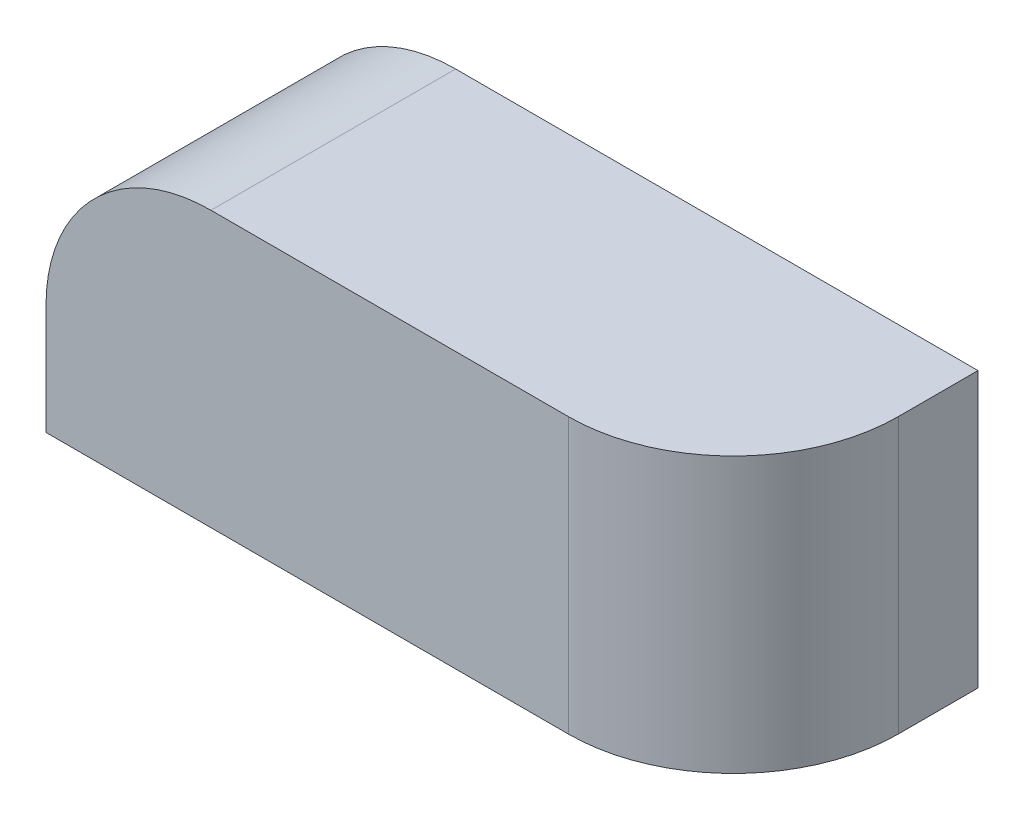
from build123d import *

# Parameters (mm, degrees)
BOSS_EXTRUDE1_DEPTH     = 89
CUT_EXTRUDE1_DEPTH      = 208.523246792
CUT_EXTRUDE1_DEPTH_BACK = 208.523246792
SKETCH3_OUTSIDE_W       = 308.718
SKETCH3_OUTSIDE_H       = 147.718
SHELL1_T                = -3.2


with BuildPart() as part:
    # Sketch2 → Boss-Extrude1 (new body)
    with BuildSketch(Plane.XY):
        with BuildLine():
            Line((-91.428571429, -28.496240602), (-91.428571429, 11.503759398))
            ThreePointArc((-91.428571429, 11.503759398), (-73.8549783, 53.93016627), (-31.428571429, 71.503759398))
            Line((-31.428571429, 71.503759398), (158.571428571, 71.503759398))
            Line((158.571428571, 71.503759398), (158.571428571, -28.496240602))
            Line((158.571428571, -28.496240602), (-91.428571429, -28.496240602))
        make_face()
    extrude(amount=-BOSS_EXTRUDE1_DEPTH)

    # Sketch3 outside → Cut-Extrude1 (cut, two sides: drawn at the far end of the back side and taken through both)
    with BuildSketch(Plane(origin=(0, 71.503759398, 0), x_dir=(1, 0, 0), z_dir=(0, 1, 0)).offset(-CUT_EXTRUDE1_DEPTH_BACK)):
        with Locations((33.571, 44.5)):
            Rectangle(SKETCH3_OUTSIDE_W, SKETCH3_OUTSIDE_H)
        with BuildLine():
            Line((-91.428571429, 0), (98.571428571, 0))
            ThreePointArc((98.571428571, 0), (140.997835443, 17.573593129), (158.571428571, 60))
            Line((158.571428571, 60), (158.571428571, 89))
            Line((158.571428571, 89), (-91.428571429, 89))
            Line((-91.428571429, 89), (-91.428571429, 0))
        make_face(mode=Mode.SUBTRACT)
    extrude(amount=CUT_EXTRUDE1_DEPTH + CUT_EXTRUDE1_DEPTH_BACK, mode=Mode.SUBTRACT)

    # Shell1
    shell1_openings = [part.faces().sort_by_distance(p)[0] for p in [
        (37.130073368, 20.336721461, -89),
    ]]
    offset(amount=SHELL1_T, openings=shell1_openings, kind=Kind.INTERSECTION)


solid = part.part
